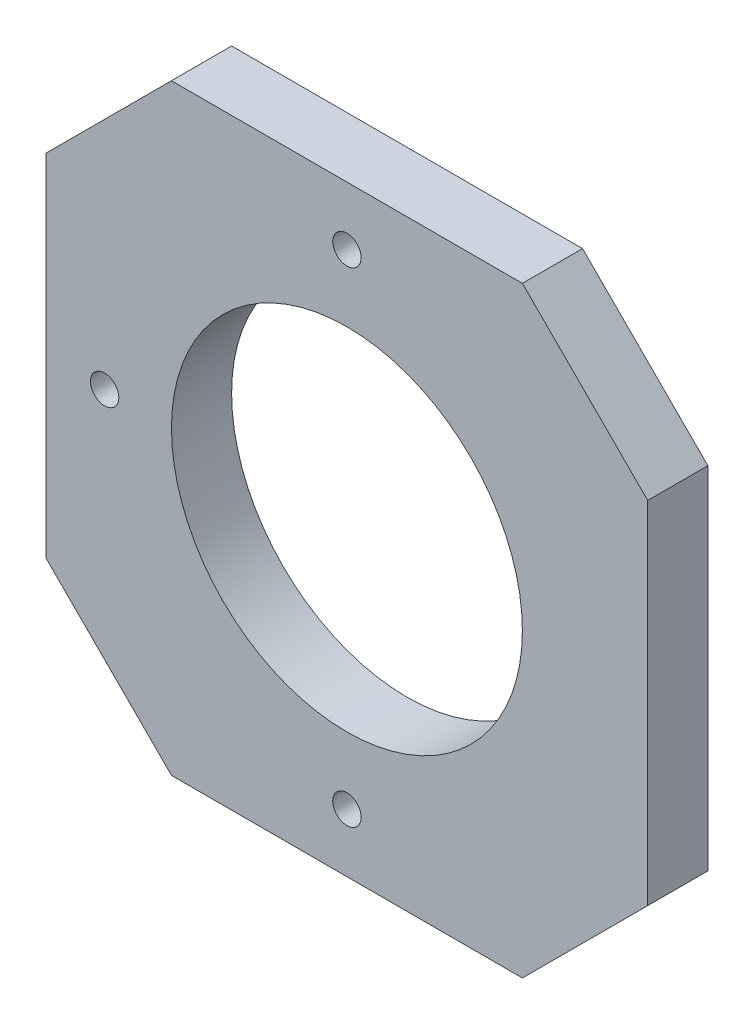
from build123d import *

# Parameters (mm, degrees)
SKETCH_1_R                      = 21
SKETCH_1_R_2                    = 1.7
F_03_BEARING_HOUSING_6806_DEPTH = 7.2


with BuildPart() as part:
    # Эскиз1 → 03_Bearing_housing_6806 (new body)
    with BuildSketch(Plane.XY):
        Polygon((-21, -36), (21, -36), (36, -21), (36, 21), (21, 36), (-21, 36), (-36, 21), (-36, -21), align=None)
        Circle(SKETCH_1_R, mode=Mode.SUBTRACT)
        with Locations((0, 29)):
            Circle(SKETCH_1_R_2, mode=Mode.SUBTRACT)
        with Locations((0, -29)):
            Circle(SKETCH_1_R_2, mode=Mode.SUBTRACT)
        with Locations((-29, 0)):
            Circle(SKETCH_1_R_2, mode=Mode.SUBTRACT)
    extrude(amount=F_03_BEARING_HOUSING_6806_DEPTH)


solid = part.part
